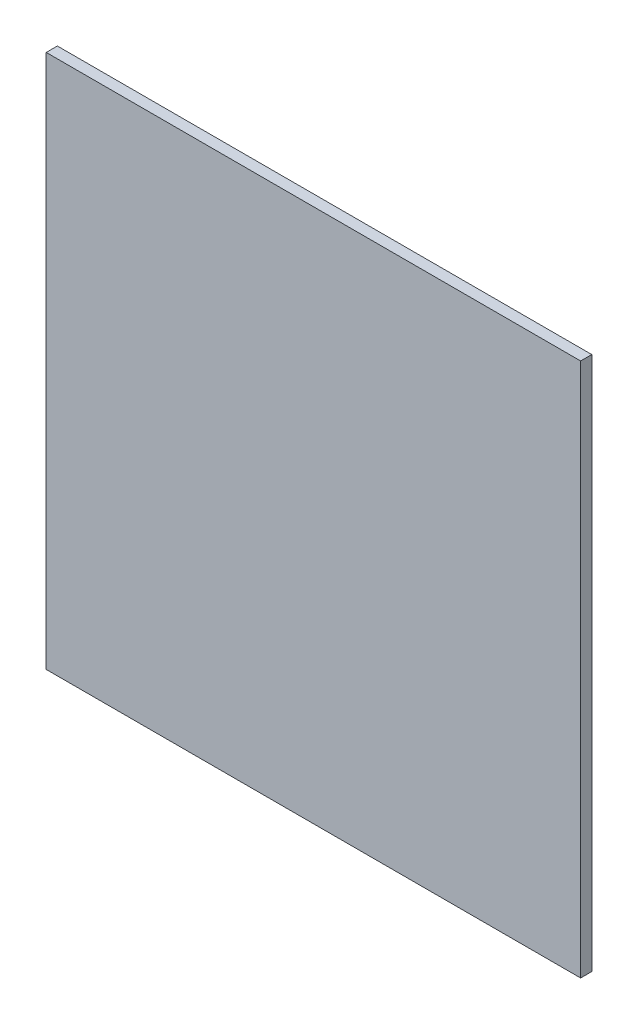
from build123d import *

# Parameters (mm, degrees)
SKETCH1_W           = 96
SKETCH1_H           = 96
BOSS_EXTRUDE2_DEPTH = 2


with BuildPart() as part:
    # Sketch1 → Boss-Extrude2 (new body)
    with BuildSketch(Plane.XY):
        with Locations((48, 48)):
            Rectangle(SKETCH1_W, SKETCH1_H)
    extrude(amount=BOSS_EXTRUDE2_DEPTH)


solid = part.part
